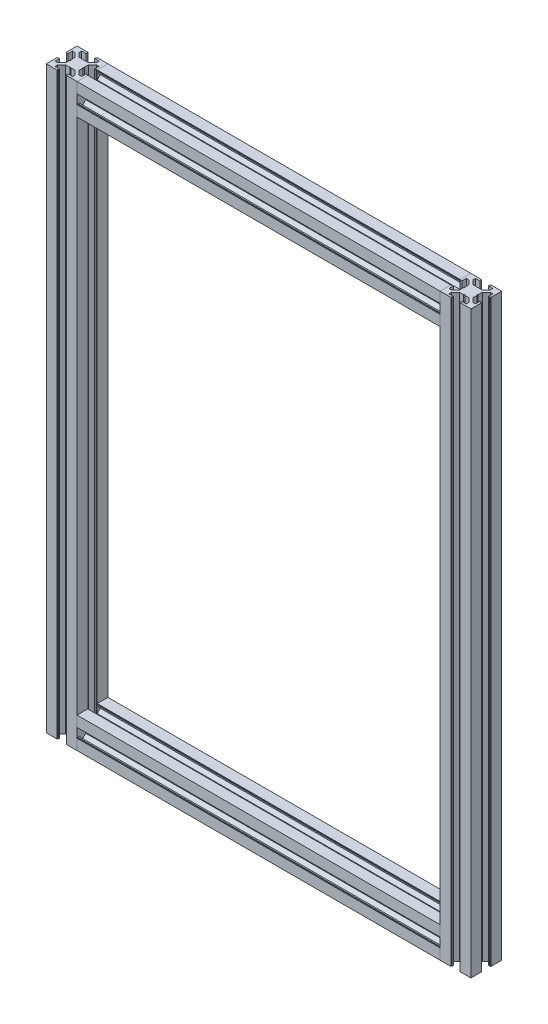
from build123d import *

# Parameters (mm, degrees)
SQUARE_TUBE_30X30_1_DEPTH         = 385
SQUARE_TUBE_30X30_1_DEPTH_BACK    = 15.005450783
SQUARE_TUBE_30X30_1_2_DEPTH       = 551.005450783
SQUARE_TUBE_30X30_1_3_DEPTH       = 400.005450783
SQUARE_TUBE_30X30_1_4_DEPTH       = 551.005450783
BODY_START                        = 535.010901566
BODY_4_RUN_ON_DEPTH               = 30
BODY_2_RUN_ON_DEPTH               = 30
SKETCH13_W                        = 4
SKETCH13_H                        = 414.010901567
F_8_0_8_DIAMETER_HOLE1_AT_2_COUNT = 2
F_8_0_8_DIAMETER_HOLE1_AT_2_PITCH = 535


with BuildPart() as part:
    # Sketch11 → Square tube 30X30(1) (new, two sides: drawn at the far end of the back side and taken through both)
    with BuildSketch(Plane(origin=(-192, 267.5, 0), x_dir=(0, 1, 0), z_dir=(1, 0, 0)).offset(-SQUARE_TUBE_30X30_1_DEPTH_BACK)):
        Polygon((-14.994549217, -4.595620131), (-14.994549217, -15.005450783), (-4.584718565, -15.005450783), (-4.584718565, -14.20463006), (-4.094549217, -14.20463006), (-4.094549217, -13.005450783), (-8.494549217, -13.005450783), (-8.494549217, -10.554198945), (-4.584718565, -6.505450783), (-0.554783858, -6.505450783), (0.010901567, -5.939765358), (0.576586992, -6.505450783), (4.595620131, -6.505450783), (8.505450783, -10.554198945), (8.505450783, -13.005450783), (4.105450783, -13.005450783), (4.105450783, -14.20463006), (4.595620131, -14.20463006), (4.595620131, -15.005450783), (15.005450783, -15.005450783), (15.005450783, -4.595620131), (14.20463006, -4.595620131), (14.20463006, -4.105450783), (13.005450783, -4.105450783), (13.005450783, -8.505450783), (10.554198945, -8.505450783), (6.505450783, -4.595620132), (6.505450783, -0.565685425), (5.939765358, 0), (6.505450783, 0.565685425), (6.505450783, 4.584718565), (10.554198945, 8.494549217), (13.005450783, 8.494549217), (13.005450783, 4.094549217), (14.20463006, 4.094549217), (14.20463006, 4.584718565), (15.005450783, 4.584718565), (15.005450783, 14.994549217), (4.595620131, 14.994549217), (4.595620131, 14.193728493), (4.105450783, 14.193728493), (4.105450783, 12.994549217), (8.505450783, 12.994549217), (8.505450783, 10.543297378), (4.595620132, 6.494549217), (0.565685425, 6.494549217), (0, 5.928863792), (-0.565685425, 6.494549217), (-4.584718565, 6.494549217), (-8.494549217, 10.543297378), (-8.494549217, 12.994549217), (-4.094549217, 12.994549217), (-4.094549217, 14.193728493), (-4.584718565, 14.193728493), (-4.584718565, 14.994549217), (-14.994549217, 14.994549217), (-14.994549217, 4.584718565), (-14.193728493, 4.584718565), (-14.193728493, 4.094549217), (-12.994549217, 4.094549217), (-12.994549217, 8.494549217), (-10.543297378, 8.494549217), (-6.494549217, 4.584718565), (-6.494549217, 0.554783858), (-5.928863792, -0.010901567), (-6.494549217, -0.576586992), (-6.494549217, -4.595620131), (-10.543297378, -8.505450783), (-12.994549217, -8.505450783), (-12.994549217, -4.105450783), (-14.193728493, -4.105450783), (-14.193728493, -4.595620131), align=None)
    extrude(amount=SQUARE_TUBE_30X30_1_DEPTH + SQUARE_TUBE_30X30_1_DEPTH_BACK)

    # Square tube 30X30(1) end butt 1
    split(bisect_by=Plane(origin=(177.005450783, 267.5, 0), x_dir=(0, -1, 0), z_dir=(-1, 0, 0)), keep=Keep.TOP)

    # Trim/Extend1
    split(bisect_by=Plane(origin=(-177.005450783, -15, -9.800535457), x_dir=(0, 1, 0), z_dir=(1, 0, 0)), keep=Keep.TOP)


with BuildPart() as body_2:
    # Sketch11 on segment 2 (carried to segment 2) → Square tube 30X30_1 2 (new body)
    with BuildSketch(Plane(origin=(192, 282.505450783, 0), x_dir=(1, 0, 0), z_dir=(0, -1, 0))):
        Polygon((-14.994549217, -4.595620131), (-14.994549217, -15.005450783), (-4.584718565, -15.005450783), (-4.584718565, -14.20463006), (-4.094549217, -14.20463006), (-4.094549217, -13.005450783), (-8.494549217, -13.005450783), (-8.494549217, -10.554198945), (-4.584718565, -6.505450783), (-0.554783858, -6.505450783), (0.010901567, -5.939765358), (0.576586992, -6.505450783), (4.595620131, -6.505450783), (8.505450783, -10.554198945), (8.505450783, -13.005450783), (4.105450783, -13.005450783), (4.105450783, -14.20463006), (4.595620131, -14.20463006), (4.595620131, -15.005450783), (15.005450783, -15.005450783), (15.005450783, -4.595620131), (14.20463006, -4.595620131), (14.20463006, -4.105450783), (13.005450783, -4.105450783), (13.005450783, -8.505450783), (10.554198945, -8.505450783), (6.505450783, -4.595620132), (6.505450783, -0.565685425), (5.939765358, 0), (6.505450783, 0.565685425), (6.505450783, 4.584718565), (10.554198945, 8.494549217), (13.005450783, 8.494549217), (13.005450783, 4.094549217), (14.20463006, 4.094549217), (14.20463006, 4.584718565), (15.005450783, 4.584718565), (15.005450783, 14.994549217), (4.595620131, 14.994549217), (4.595620131, 14.193728493), (4.105450783, 14.193728493), (4.105450783, 12.994549217), (8.505450783, 12.994549217), (8.505450783, 10.543297378), (4.595620132, 6.494549217), (0.565685425, 6.494549217), (0, 5.928863792), (-0.565685425, 6.494549217), (-4.584718565, 6.494549217), (-8.494549217, 10.543297378), (-8.494549217, 12.994549217), (-4.094549217, 12.994549217), (-4.094549217, 14.193728493), (-4.584718565, 14.193728493), (-4.584718565, 14.994549217), (-14.994549217, 14.994549217), (-14.994549217, 4.584718565), (-14.193728493, 4.584718565), (-14.193728493, 4.094549217), (-12.994549217, 4.094549217), (-12.994549217, 8.494549217), (-10.543297378, 8.494549217), (-6.494549217, 4.584718565), (-6.494549217, 0.554783858), (-5.928863792, -0.010901567), (-6.494549217, -0.576586992), (-6.494549217, -4.595620131), (-10.543297378, -8.505450783), (-12.994549217, -8.505450783), (-12.994549217, -4.105450783), (-14.193728493, -4.105450783), (-14.193728493, -4.595620131), align=None)
    extrude(amount=SQUARE_TUBE_30X30_1_2_DEPTH)

    # Square tube 30X30_1 2 end butt 1
    split(bisect_by=Plane(origin=(192, -252.505450783, 0), x_dir=(-1, 0, 0), z_dir=(0, 1, 0)), keep=Keep.TOP)

    # Sketch11 on segment 2 (carried to segment 2) → body 2 run on (add)
    with BuildSketch(Plane(origin=(192, 282.505450783, 0), x_dir=(1, 0, 0), z_dir=(0, -1, 0)).offset(BODY_START)):
        Polygon((-14.994549217, -4.595620131), (-14.994549217, -15.005450783), (-4.584718565, -15.005450783), (-4.584718565, -14.20463006), (-4.094549217, -14.20463006), (-4.094549217, -13.005450783), (-8.494549217, -13.005450783), (-8.494549217, -10.554198945), (-4.584718565, -6.505450783), (-0.554783858, -6.505450783), (0.010901567, -5.939765358), (0.576586992, -6.505450783), (4.595620131, -6.505450783), (8.505450783, -10.554198945), (8.505450783, -13.005450783), (4.105450783, -13.005450783), (4.105450783, -14.20463006), (4.595620131, -14.20463006), (4.595620131, -15.005450783), (15.005450783, -15.005450783), (15.005450783, -4.595620131), (14.20463006, -4.595620131), (14.20463006, -4.105450783), (13.005450783, -4.105450783), (13.005450783, -8.505450783), (10.554198945, -8.505450783), (6.505450783, -4.595620132), (6.505450783, -0.565685425), (5.939765358, 0), (6.505450783, 0.565685425), (6.505450783, 4.584718565), (10.554198945, 8.494549217), (13.005450783, 8.494549217), (13.005450783, 4.094549217), (14.20463006, 4.094549217), (14.20463006, 4.584718565), (15.005450783, 4.584718565), (15.005450783, 14.994549217), (4.595620131, 14.994549217), (4.595620131, 14.193728493), (4.105450783, 14.193728493), (4.105450783, 12.994549217), (8.505450783, 12.994549217), (8.505450783, 10.543297378), (4.595620132, 6.494549217), (0.565685425, 6.494549217), (0, 5.928863792), (-0.565685425, 6.494549217), (-4.584718565, 6.494549217), (-8.494549217, 10.543297378), (-8.494549217, 12.994549217), (-4.094549217, 12.994549217), (-4.094549217, 14.193728493), (-4.584718565, 14.193728493), (-4.584718565, 14.994549217), (-14.994549217, 14.994549217), (-14.994549217, 4.584718565), (-14.193728493, 4.584718565), (-14.193728493, 4.094549217), (-12.994549217, 4.094549217), (-12.994549217, 8.494549217), (-10.543297378, 8.494549217), (-6.494549217, 4.584718565), (-6.494549217, 0.554783858), (-5.928863792, -0.010901567), (-6.494549217, -0.576586992), (-6.494549217, -4.595620131), (-10.543297378, -8.505450783), (-12.994549217, -8.505450783), (-12.994549217, -4.105450783), (-14.193728493, -4.105450783), (-14.193728493, -4.595620131), align=None)
    extrude(amount=BODY_2_RUN_ON_DEPTH)


with BuildPart() as body_3:
    # Sketch11 on segment 3 (carried to segment 3) → Square tube 30X30_1 3 (new body)
    with BuildSketch(Plane(origin=(207.005450783, -267.5, 0), x_dir=(0, -1, 0), z_dir=(-1, 0, 0))):
        Polygon((-14.994549217, -4.595620131), (-14.994549217, -15.005450783), (-4.584718565, -15.005450783), (-4.584718565, -14.20463006), (-4.094549217, -14.20463006), (-4.094549217, -13.005450783), (-8.494549217, -13.005450783), (-8.494549217, -10.554198945), (-4.584718565, -6.505450783), (-0.554783858, -6.505450783), (0.010901567, -5.939765358), (0.576586992, -6.505450783), (4.595620131, -6.505450783), (8.505450783, -10.554198945), (8.505450783, -13.005450783), (4.105450783, -13.005450783), (4.105450783, -14.20463006), (4.595620131, -14.20463006), (4.595620131, -15.005450783), (15.005450783, -15.005450783), (15.005450783, -4.595620131), (14.20463006, -4.595620131), (14.20463006, -4.105450783), (13.005450783, -4.105450783), (13.005450783, -8.505450783), (10.554198945, -8.505450783), (6.505450783, -4.595620132), (6.505450783, -0.565685425), (5.939765358, 0), (6.505450783, 0.565685425), (6.505450783, 4.584718565), (10.554198945, 8.494549217), (13.005450783, 8.494549217), (13.005450783, 4.094549217), (14.20463006, 4.094549217), (14.20463006, 4.584718565), (15.005450783, 4.584718565), (15.005450783, 14.994549217), (4.595620131, 14.994549217), (4.595620131, 14.193728493), (4.105450783, 14.193728493), (4.105450783, 12.994549217), (8.505450783, 12.994549217), (8.505450783, 10.543297378), (4.595620132, 6.494549217), (0.565685425, 6.494549217), (0, 5.928863792), (-0.565685425, 6.494549217), (-4.584718565, 6.494549217), (-8.494549217, 10.543297378), (-8.494549217, 12.994549217), (-4.094549217, 12.994549217), (-4.094549217, 14.193728493), (-4.584718565, 14.193728493), (-4.584718565, 14.994549217), (-14.994549217, 14.994549217), (-14.994549217, 4.584718565), (-14.193728493, 4.584718565), (-14.193728493, 4.094549217), (-12.994549217, 4.094549217), (-12.994549217, 8.494549217), (-10.543297378, 8.494549217), (-6.494549217, 4.584718565), (-6.494549217, 0.554783858), (-5.928863792, -0.010901567), (-6.494549217, -0.576586992), (-6.494549217, -4.595620131), (-10.543297378, -8.505450783), (-12.994549217, -8.505450783), (-12.994549217, -4.105450783), (-14.193728493, -4.105450783), (-14.193728493, -4.595620131), align=None)
    extrude(amount=SQUARE_TUBE_30X30_1_3_DEPTH)

    # Square tube 30X30_1 3 end butt 1
    split(bisect_by=Plane(origin=(-177.005450783, -267.5, 0), x_dir=(0, 1, 0), z_dir=(1, 0, 0)), keep=Keep.TOP)

    # Trim/Extend3
    split(bisect_by=Plane(origin=(177.005450783, 15, -9.800535457), x_dir=(0, -1, 0), z_dir=(-1, 0, 0)), keep=Keep.TOP)


with BuildPart() as body_4:
    # Sketch11 on segment 4 (carried to segment 4) → Square tube 30X30_1 4 (new body)
    with BuildSketch(Plane(origin=(-192, -282.505450783, 0), x_dir=(-1, 0, 0), z_dir=(0, 1, 0))):
        Polygon((-14.994549217, -4.595620131), (-14.994549217, -15.005450783), (-4.584718565, -15.005450783), (-4.584718565, -14.20463006), (-4.094549217, -14.20463006), (-4.094549217, -13.005450783), (-8.494549217, -13.005450783), (-8.494549217, -10.554198945), (-4.584718565, -6.505450783), (-0.554783858, -6.505450783), (0.010901567, -5.939765358), (0.576586992, -6.505450783), (4.595620131, -6.505450783), (8.505450783, -10.554198945), (8.505450783, -13.005450783), (4.105450783, -13.005450783), (4.105450783, -14.20463006), (4.595620131, -14.20463006), (4.595620131, -15.005450783), (15.005450783, -15.005450783), (15.005450783, -4.595620131), (14.20463006, -4.595620131), (14.20463006, -4.105450783), (13.005450783, -4.105450783), (13.005450783, -8.505450783), (10.554198945, -8.505450783), (6.505450783, -4.595620132), (6.505450783, -0.565685425), (5.939765358, 0), (6.505450783, 0.565685425), (6.505450783, 4.584718565), (10.554198945, 8.494549217), (13.005450783, 8.494549217), (13.005450783, 4.094549217), (14.20463006, 4.094549217), (14.20463006, 4.584718565), (15.005450783, 4.584718565), (15.005450783, 14.994549217), (4.595620131, 14.994549217), (4.595620131, 14.193728493), (4.105450783, 14.193728493), (4.105450783, 12.994549217), (8.505450783, 12.994549217), (8.505450783, 10.543297378), (4.595620132, 6.494549217), (0.565685425, 6.494549217), (0, 5.928863792), (-0.565685425, 6.494549217), (-4.584718565, 6.494549217), (-8.494549217, 10.543297378), (-8.494549217, 12.994549217), (-4.094549217, 12.994549217), (-4.094549217, 14.193728493), (-4.584718565, 14.193728493), (-4.584718565, 14.994549217), (-14.994549217, 14.994549217), (-14.994549217, 4.584718565), (-14.193728493, 4.584718565), (-14.193728493, 4.094549217), (-12.994549217, 4.094549217), (-12.994549217, 8.494549217), (-10.543297378, 8.494549217), (-6.494549217, 4.584718565), (-6.494549217, 0.554783858), (-5.928863792, -0.010901567), (-6.494549217, -0.576586992), (-6.494549217, -4.595620131), (-10.543297378, -8.505450783), (-12.994549217, -8.505450783), (-12.994549217, -4.105450783), (-14.193728493, -4.105450783), (-14.193728493, -4.595620131), align=None)
    extrude(amount=SQUARE_TUBE_30X30_1_4_DEPTH)

    # Square tube 30X30_1 4 end butt 1
    split(bisect_by=Plane(origin=(-192, 252.505450783, 0), x_dir=(1, 0, 0), z_dir=(0, -1, 0)), keep=Keep.TOP)

    # Sketch11 on segment 4 (carried to segment 4) → body 4 run on (add)
    with BuildSketch(Plane(origin=(-192, -282.505450783, 0), x_dir=(-1, 0, 0), z_dir=(0, 1, 0)).offset(BODY_START)):
        Polygon((-14.994549217, -4.595620131), (-14.994549217, -15.005450783), (-4.584718565, -15.005450783), (-4.584718565, -14.20463006), (-4.094549217, -14.20463006), (-4.094549217, -13.005450783), (-8.494549217, -13.005450783), (-8.494549217, -10.554198945), (-4.584718565, -6.505450783), (-0.554783858, -6.505450783), (0.010901567, -5.939765358), (0.576586992, -6.505450783), (4.595620131, -6.505450783), (8.505450783, -10.554198945), (8.505450783, -13.005450783), (4.105450783, -13.005450783), (4.105450783, -14.20463006), (4.595620131, -14.20463006), (4.595620131, -15.005450783), (15.005450783, -15.005450783), (15.005450783, -4.595620131), (14.20463006, -4.595620131), (14.20463006, -4.105450783), (13.005450783, -4.105450783), (13.005450783, -8.505450783), (10.554198945, -8.505450783), (6.505450783, -4.595620132), (6.505450783, -0.565685425), (5.939765358, 0), (6.505450783, 0.565685425), (6.505450783, 4.584718565), (10.554198945, 8.494549217), (13.005450783, 8.494549217), (13.005450783, 4.094549217), (14.20463006, 4.094549217), (14.20463006, 4.584718565), (15.005450783, 4.584718565), (15.005450783, 14.994549217), (4.595620131, 14.994549217), (4.595620131, 14.193728493), (4.105450783, 14.193728493), (4.105450783, 12.994549217), (8.505450783, 12.994549217), (8.505450783, 10.543297378), (4.595620132, 6.494549217), (0.565685425, 6.494549217), (0, 5.928863792), (-0.565685425, 6.494549217), (-4.584718565, 6.494549217), (-8.494549217, 10.543297378), (-8.494549217, 12.994549217), (-4.094549217, 12.994549217), (-4.094549217, 14.193728493), (-4.584718565, 14.193728493), (-4.584718565, 14.994549217), (-14.994549217, 14.994549217), (-14.994549217, 4.584718565), (-14.193728493, 4.584718565), (-14.193728493, 4.094549217), (-12.994549217, 4.094549217), (-12.994549217, 8.494549217), (-10.543297378, 8.494549217), (-6.494549217, 4.584718565), (-6.494549217, 0.554783858), (-5.928863792, -0.010901567), (-6.494549217, -0.576586992), (-6.494549217, -4.595620131), (-10.543297378, -8.505450783), (-12.994549217, -8.505450783), (-12.994549217, -4.105450783), (-14.193728493, -4.105450783), (-14.193728493, -4.595620131), align=None)
    extrude(amount=BODY_4_RUN_ON_DEPTH)


with BuildPart() as f_8_0_8_diameter_hole1_tool:
    # Sketch13 → Ø8.0 (8) Diameter Hole1 (revolve)
    with BuildSketch(Plane(origin=(-207.005450783, 267.5, 0), x_dir=(0, 0, 1), z_dir=(0, 1, 0))):
        with Locations((2, 207.005450784)):
            Rectangle(SKETCH13_W, SKETCH13_H)
    f_8_0_8_diameter_hole1 = revolve(axis=Axis((-213.355450783, 267.5, 0), (1, 0, 0)))


with BuildPart() as part_1:
    add(part.part)

    # Ø8.0 (8) Diameter Hole1: cut by f_8_0_8_diameter_hole1_tool
    add(f_8_0_8_diameter_hole1_tool.part, mode=Mode.SUBTRACT)


with BuildPart() as body_2_1:
    add(body_2.part)

    # Ø8.0 (8) Diameter Hole1: cut by f_8_0_8_diameter_hole1_tool
    add(f_8_0_8_diameter_hole1_tool.part, mode=Mode.SUBTRACT)


with BuildPart() as body_4_1:
    add(body_4.part)

    # Ø8.0 (8) Diameter Hole1: cut by f_8_0_8_diameter_hole1_tool
    add(f_8_0_8_diameter_hole1_tool.part, mode=Mode.SUBTRACT)


with BuildPart() as f_8_0_8_diameter_hole1_at_2_tool:
    # Ø8.0 (8) Diameter Hole1 at 2: Ø8.0 (8) Diameter Hole1 ×2
    with Locations(*[(0, -i * F_8_0_8_DIAMETER_HOLE1_AT_2_PITCH, 0) for i in range(1, F_8_0_8_DIAMETER_HOLE1_AT_2_COUNT)]):
        add(f_8_0_8_diameter_hole1)


with BuildPart() as body_2_2:
    add(body_2_1.part)

    # Ø8.0 (8) Diameter Hole1 at 2: cut by f_8_0_8_diameter_hole1_at_2_tool
    add(f_8_0_8_diameter_hole1_at_2_tool.part, mode=Mode.SUBTRACT)


with BuildPart() as body_3_1:
    add(body_3.part)

    # Ø8.0 (8) Diameter Hole1 at 2: cut by f_8_0_8_diameter_hole1_at_2_tool
    add(f_8_0_8_diameter_hole1_at_2_tool.part, mode=Mode.SUBTRACT)


with BuildPart() as body_4_2:
    add(body_4_1.part)

    # Ø8.0 (8) Diameter Hole1 at 2: cut by f_8_0_8_diameter_hole1_at_2_tool
    add(f_8_0_8_diameter_hole1_at_2_tool.part, mode=Mode.SUBTRACT)


solid = Compound([part_1.part, body_2_2.part, body_3_1.part, body_4_2.part])
